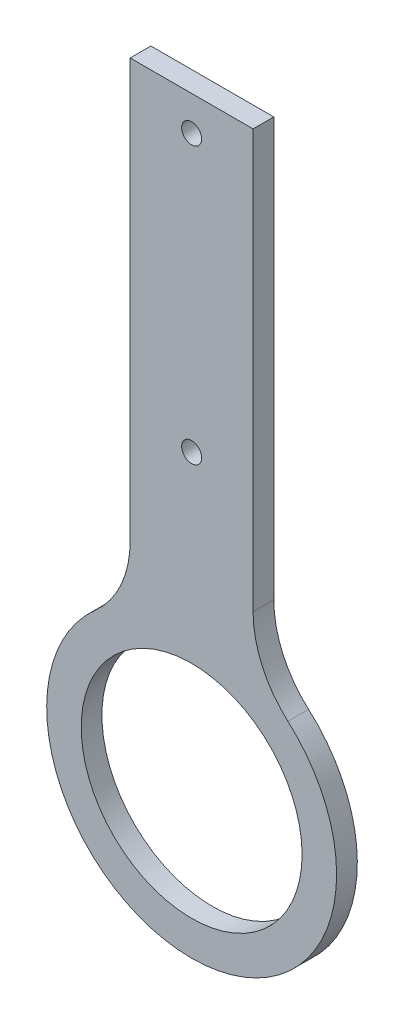
from build123d import *

# Parameters (mm, degrees)
SKETCH_1_R          = 21
SKETCH_1_R_2        = 16
EXTRUDE_1_DEPTH     = 3
SKETCH_2_W          = 17.8
SKETCH_2_H          = 75
SKETCH_2_R          = 1.45
EXTRUDE_2_DEPTH     = 3
SKETCH_3_R          = 16
CUT_EXTRUDE_1_DEPTH = 91.034715527
FILLET_1_R          = 15


with BuildPart() as part:
    # 草图1 → 凸台-拉伸1 (new body)
    with BuildSketch(Plane.XY):
        Circle(SKETCH_1_R)
        Circle(SKETCH_1_R_2, mode=Mode.SUBTRACT)
    extrude(amount=EXTRUDE_1_DEPTH)

    # 草图2 → 凸台-拉伸2 (add)
    with BuildSketch(Plane.XY):
        with Locations((0, 50)):
            Rectangle(SKETCH_2_W, SKETCH_2_H)
        with Locations((0, 42.5)):
            Circle(SKETCH_2_R, mode=Mode.SUBTRACT)
        with Locations((0, 82.5)):
            Circle(SKETCH_2_R, mode=Mode.SUBTRACT)
    extrude(amount=EXTRUDE_2_DEPTH)

    # 草图3 → 切除-拉伸1 (cut, through all)
    with BuildSketch(Plane.XY.offset(3)):
        Circle(SKETCH_3_R)
    extrude(amount=-CUT_EXTRUDE_1_DEPTH, mode=Mode.SUBTRACT)

    # 圆角1
    fillet_1_edges = [part.edges().sort_by_distance(p)[0] for p in [
        (8.9, 19.020778112, 1.5),
        (-8.9, 19.020778112, 1.5),
    ]]
    fillet(fillet_1_edges, radius=FILLET_1_R)


solid = part.part
